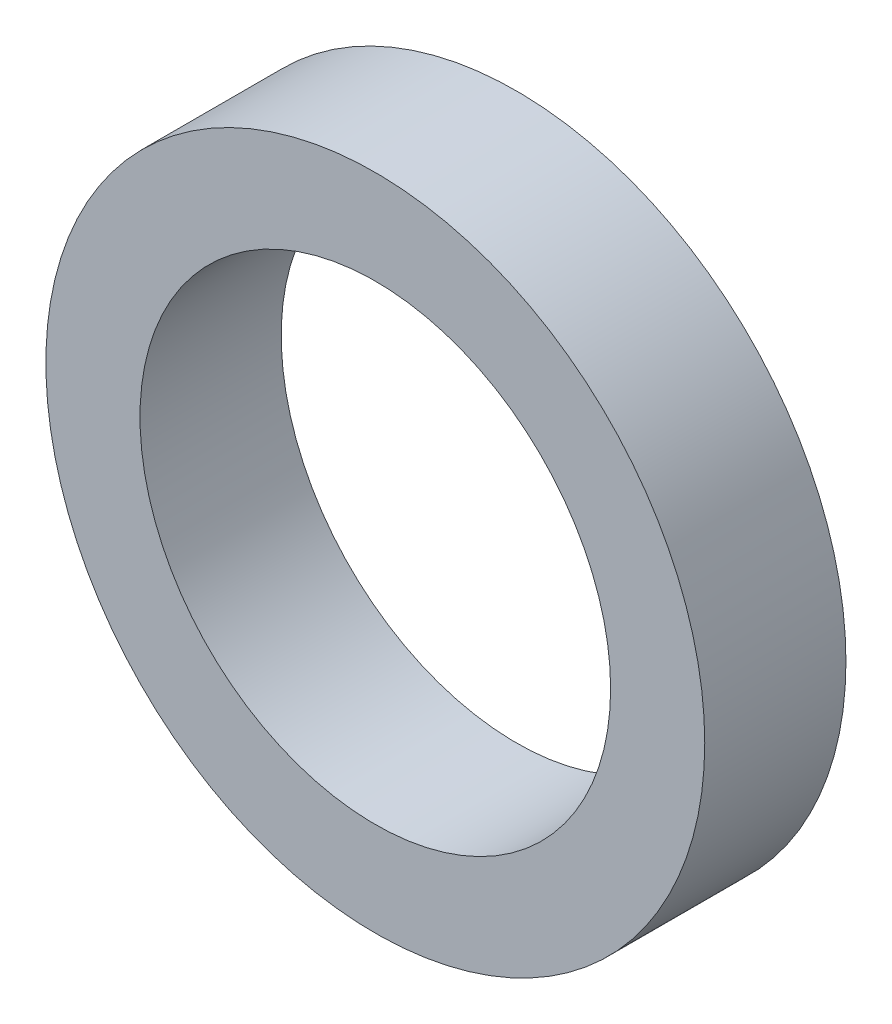
from build123d import *

# Parameters (mm, degrees)
ESQUISSE1_R      = 2.1
ESQUISSE1_R_2    = 1.5
EXTRUSION1_DEPTH = 0.9


with BuildPart() as part:
    # Esquisse1 → Extrusion1 (new body)
    with BuildSketch(Plane.XY):
        Circle(ESQUISSE1_R)
        Circle(ESQUISSE1_R_2, mode=Mode.SUBTRACT)
    extrude(amount=EXTRUSION1_DEPTH)


solid = part.part
